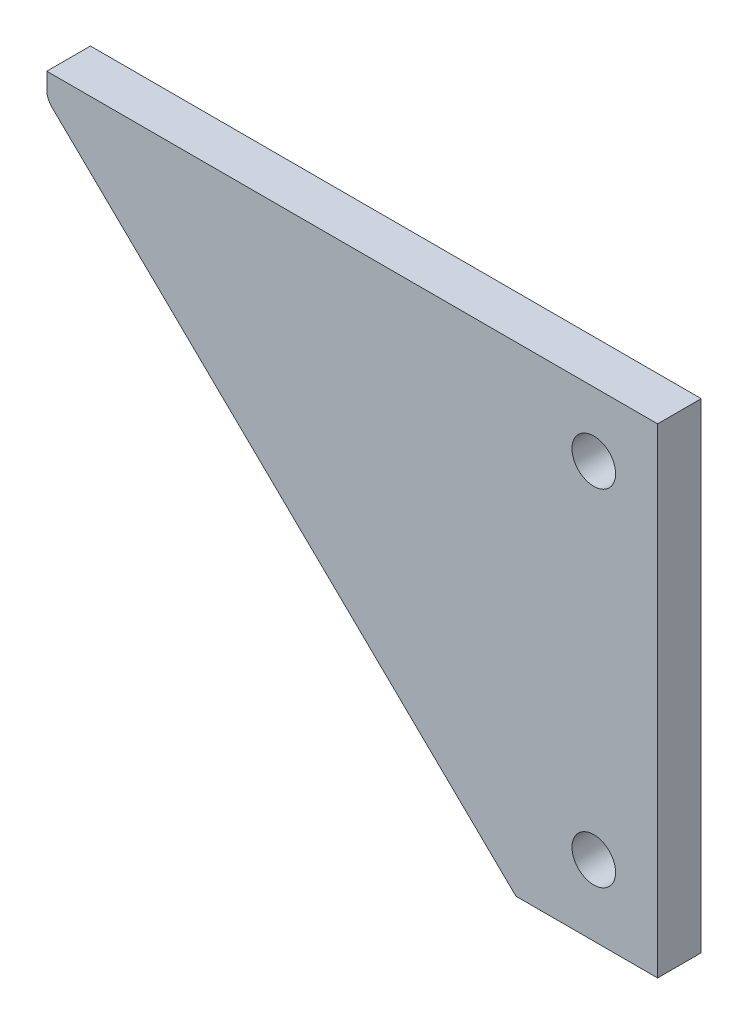
from build123d import *

# Parameters (mm, degrees)
ESQUISSE1_R        = 2.5
BOSS_EXTRU_2_DEPTH = 5
CONG_2_R           = 2


with BuildPart() as part:
    # Esquisse1 → Boss.-Extru.2 (new body)
    with BuildSketch(Plane.XY):
        Polygon((-39.751873238, 27.403100775), (30.248126762, 27.403100775), (30.248126762, -27.596899225), (14.016967887, -27.596899225), (-39.751873238, 24.689922481), align=None)
        with Locations((22.936263184, 20.04525616)):
            Circle(ESQUISSE1_R, mode=Mode.SUBTRACT)
        with Locations((22.936263184, -19.519610844)):
            Circle(ESQUISSE1_R, mode=Mode.SUBTRACT)
    extrude(amount=BOSS_EXTRU_2_DEPTH)

    # Congé2
    cong_2_edges = [part.edges().sort_by_distance(p)[0] for p in [
        (-39.751873238, 24.689922481, 2.5),
    ]]
    fillet(cong_2_edges, radius=CONG_2_R)


solid = part.part
